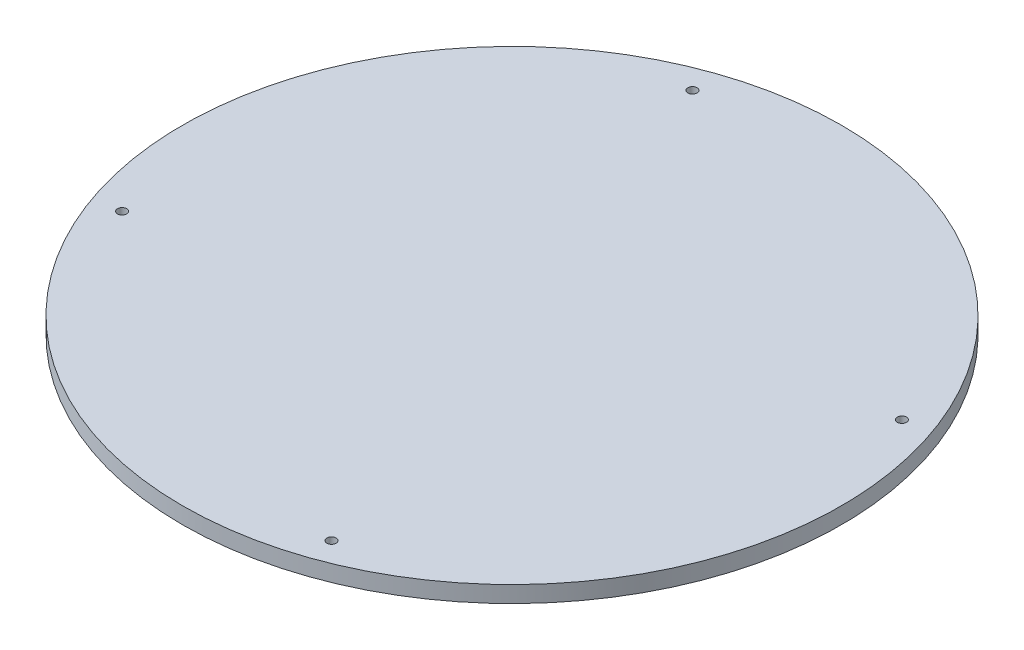
from build123d import *

# Parameters (mm, degrees)
SKETCH1_R                                           = 50
BOSS_EXTRUDE1_DEPTH                                 = 2.5
CBORE_FOR_00_BINDING_HEAD_MACHINE_SCREW_D           = 1.397
CBORE_FOR_00_BINDING_HEAD_MACHINE_SCREW_DEPTH       = 7.5
CBORE_FOR_00_BINDING_HEAD_MACHINE_SCREW_CBORE_D     = 3.175
CBORE_FOR_00_BINDING_HEAD_MACHINE_SCREW_CBORE_DEPTH = 0.7112
CBORE_FOR_00_BINDING_HEAD_MACHINE_SCREW_TIP         = 0.419701142


with BuildPart() as part:
    # Sketch1 → Boss-Extrude1 (new body)
    with BuildSketch(Plane(origin=(0, 0, 0), x_dir=(1, 0, 0), z_dir=(0, 1, 0))):
        with Locations(Location((0, 0, 0), (0, 0, 270))):
            Circle(SKETCH1_R)
    extrude(amount=BOSS_EXTRUDE1_DEPTH)

    # CBORE for #00 Binding Head Machine Screw1
    with Locations(Plane(origin=(-15.891003533, 0, -43.270503311), x_dir=(0, 0, -1), z_dir=(0, -1, 0))):
        with Locations((0, 0), (-59.161506844, -27.379499778), (-86.541006622, 31.782007066), (-27.379499778, 59.161506844)):
            CounterBoreHole(CBORE_FOR_00_BINDING_HEAD_MACHINE_SCREW_D / 2, CBORE_FOR_00_BINDING_HEAD_MACHINE_SCREW_CBORE_D / 2, CBORE_FOR_00_BINDING_HEAD_MACHINE_SCREW_CBORE_DEPTH, depth=CBORE_FOR_00_BINDING_HEAD_MACHINE_SCREW_DEPTH)
            with Locations((0, 0, -(CBORE_FOR_00_BINDING_HEAD_MACHINE_SCREW_DEPTH + CBORE_FOR_00_BINDING_HEAD_MACHINE_SCREW_TIP / 2))):  # 118° drill point
                Cone(0, CBORE_FOR_00_BINDING_HEAD_MACHINE_SCREW_D / 2, CBORE_FOR_00_BINDING_HEAD_MACHINE_SCREW_TIP, mode=Mode.SUBTRACT)


solid = part.part
